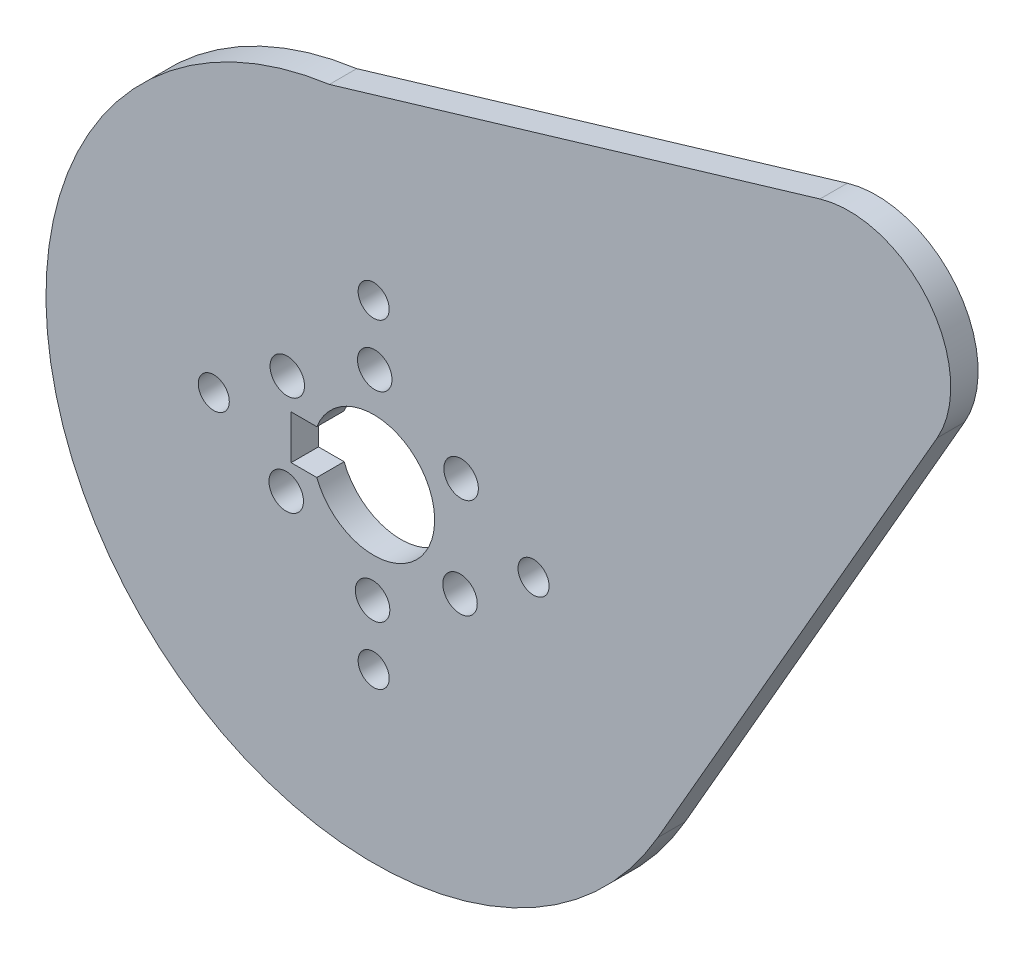
from build123d import *

# Parameters (mm, degrees)
SKETCH1_R             = 7.07
BOSS_EXTRUDE2_DEPTH   = 3.17
SKETCH2_R             = 1.799813297
CUT_EXTRUDE1_DEPTH    = 3.17
CIRPATTERN1_COUNT     = 4
F_4_0MM_DOWEL_HOLE1_D = 4
CIRPATTERN2_COUNT     = 6
CUT_EXTRUDE2_REACH    = 88.731


with BuildPart() as part:
    # Sketch1 → Boss-Extrude2 (new body)
    # profile 1 of 2: a face of its own
    with BuildSketch(Plane.XY):
        with BuildLine():
            ThreePointArc((-5.13430178, 37.651546386), (-31.529571408, -21.210519249), (32.94, -18.946144727))
            ThreePointArc((32.94, -18.946144727), (36.71321288, -9.805100713), (38, 0))
            ThreePointArc((38, 0), (24.988962887, 28.62781399), (-5.13430178, 37.651546386))
        make_face()
        Circle(SKETCH1_R, mode=Mode.SUBTRACT)
    # profile 2 of 2: a face of its own
    with BuildSketch(Plane.XY):
        with BuildLine():
            ThreePointArc((38, 0), (36.71321288, -9.805100713), (32.94, -18.946144727))
            Line((32.94, -18.946144727), (65.347879138, 37.398592116))
            ThreePointArc((65.347879138, 37.398592116), (64.374631715, 50.601425699), (51.751457407, 54.591099312))
            Line((51.751457407, 54.591099312), (-5.13430178, 37.651546386))
            ThreePointArc((-5.13430178, 37.651546386), (24.988962887, 28.62781399), (38, 0))
        make_face()
    extrude(amount=BOSS_EXTRUDE2_DEPTH)

    # Sketch2 → Cut-Extrude1 (cut)
    with BuildSketch(Plane.XY.offset(3.17)):
        with Locations((-18.54, 0)):
            Circle(SKETCH2_R)
    cut_extrude1 = extrude(amount=-CUT_EXTRUDE1_DEPTH, mode=Mode.SUBTRACT)

    # CirPattern1: Cut-Extrude1 ×4 about axis
    cirpattern1_axis = Axis((0, 0, 0), (0, 0, 1))
    for i in range(1, CIRPATTERN1_COUNT):
        add(cut_extrude1.rotate(cirpattern1_axis, i * 360 / CIRPATTERN1_COUNT), mode=Mode.SUBTRACT)

    # Ø4.0mm Dowel Hole1 (through all)
    with Locations(Plane.XY.offset(3.17)):
        with Locations((-10.14, -5.71)):
            f_4_0mm_dowel_hole1 = Hole(F_4_0MM_DOWEL_HOLE1_D / 2)

    # CirPattern2: Ø4.0mm Dowel Hole1 ×6 about axis
    cirpattern2_axis = Axis((0, 0, 0), (0, 0, 1))
    for i in range(1, CIRPATTERN2_COUNT):
        add(f_4_0mm_dowel_hole1.rotate(cirpattern2_axis, i * 360 / CIRPATTERN2_COUNT), mode=Mode.SUBTRACT)

    # Sketch5 → Cut-Extrude2 (cut, up to next)
    with BuildSketch(Plane(origin=(0, 0, 0), x_dir=(-1, 0, 0), z_dir=(0, 0, -1)), mode=Mode.PRIVATE) as cut_extrude2_sk1:
        with BuildLine():
            Line((6.594118592, 2.55), (9.57, 2.55))
            Line((9.57, 2.55), (9.57, -2.55))
            Line((9.57, -2.55), (6.594118592, -2.55))
            ThreePointArc((6.594118592, -2.55), (7.07, 0), (6.594118592, 2.55))
        make_face()
    cut_extrude2_tool1 = extrude(cut_extrude2_sk1.sketch, amount=-CUT_EXTRUDE2_REACH, mode=Mode.PRIVATE) & part.part
    add(cut_extrude2_tool1.solids().sort_by_distance((-8.238036, 0, 0))[0], mode=Mode.SUBTRACT)


solid = part.part
